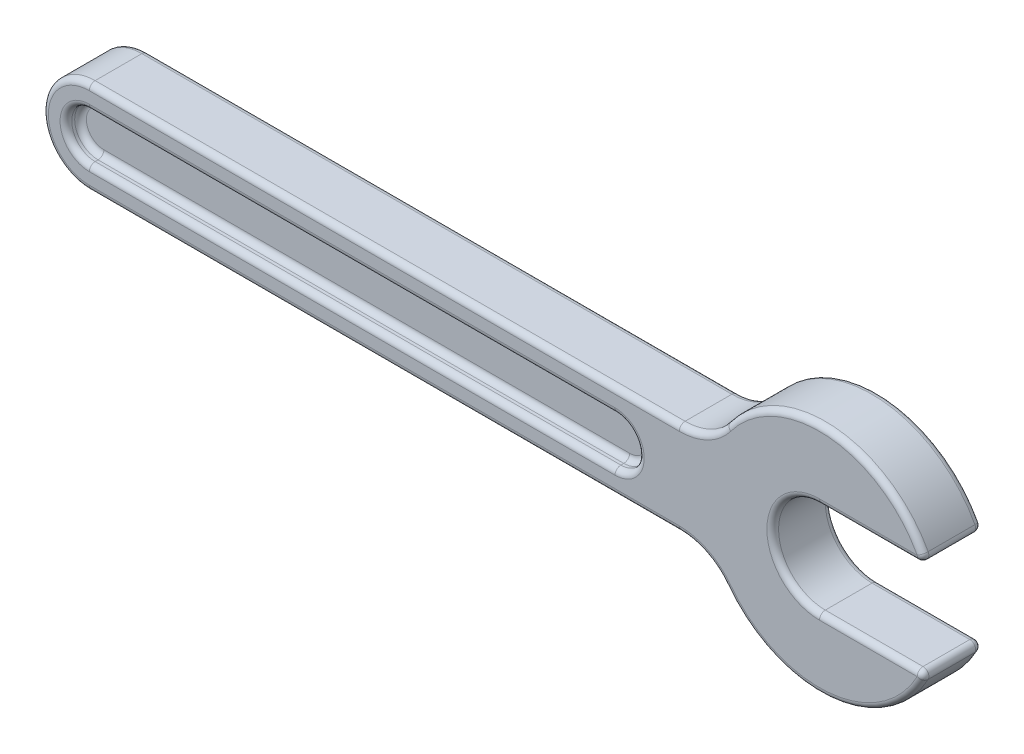
from build123d import *

# Parameters (mm, degrees)
BOSS_EXTRUDE5_DEPTH = 10
BOSS_EXTRUDE6_DEPTH = 5
FILLET1_R           = 2


with BuildPart() as part:
    # Sketch1 → Boss-Extrude5 (new, symmetric)
    with BuildSketch(Plane.XY):
        with BuildLine():
            Line((36.66060556, 16), (0, 16))
            ThreePointArc((0, 16), (-16, 0), (0, -16))
            Line((0, -16), (36.66060556, -16))
            ThreePointArc((36.66060556, -16), (4.629288395, -39.731218065), (-32, -24))
            ThreePointArc((-32, -24), (-39.05572809, -18.11145618), (-48, -16))
            Line((-48, -16), (-250, -16))
            ThreePointArc((-250, -16), (-266, 0), (-250, 16))
            Line((-250, 16), (-48, 16))
            ThreePointArc((-48, 16), (-39.05572809, 18.11145618), (-32, 24))
            ThreePointArc((-32, 24), (4.629288395, 39.731218065), (36.66060556, 16))
        make_face()
        with BuildLine():
            Line((-250, 8), (-70, 8))
            ThreePointArc((-70, 8), (-62, 0), (-70, -8))
            Line((-70, -8), (-250, -8))
            ThreePointArc((-250, -8), (-258, 0), (-250, 8))
        make_face(mode=Mode.SUBTRACT)
    extrude(amount=BOSS_EXTRUDE5_DEPTH, both=True)

    # Sketch1<8> → Boss-Extrude6 (add, symmetric)
    with BuildSketch(Plane.XY):
        with BuildLine():
            Line((-70, 8), (-250, 8))
            ThreePointArc((-250, 8), (-258, 0), (-250, -8))
            Line((-250, -8), (-70, -8))
            ThreePointArc((-70, -8), (-62, 0), (-70, 8))
        make_face()
    extrude(amount=BOSS_EXTRUDE6_DEPTH, both=True)

    # Fillet1
    fillet1_edges = [part.edges().sort_by_distance(p)[0] for p in [
        (36.66060556, 16, 0),
        (36.66060556, -16, 0),
        (18.33030278, 16, 10),
        (4.629288395, 39.731218065, 10),
        (-39.05572809, 18.11145618, 10),
        (-149, 16, 10),
        (-266, 0, 10),
        (-149, -16, 10),
        (-39.05572809, -18.11145618, 10),
        (4.629288395, -39.731218065, 10),
        (18.33030278, -16, 10),
        (-16, 0, 10),
        (18.33030278, 16, -10),
        (4.629288395, 39.731218065, -10),
        (-39.05572809, 18.11145618, -10),
        (-149, 16, -10),
        (-266, 0, -10),
        (-149, -16, -10),
        (-39.05572809, -18.11145618, -10),
        (4.629288395, -39.731218065, -10),
        (18.33030278, -16, -10),
        (-16, 0, -10),
        (-160, 8, 10),
        (-62, 0, 10),
        (-160, -8, 10),
        (-258, 0, 10),
        (-160, 8, -10),
        (-62, 0, -10),
        (-160, -8, -10),
        (-258, 0, -10),
        (-258, 0, 5),
        (-160, 8, 5),
        (-62, 0, 5),
        (-160, -8, 5),
        (-258, 0, -5),
        (-160, 8, -5),
        (-62, 0, -5),
        (-160, -8, -5),
    ]]
    fillet(fillet1_edges, radius=FILLET1_R)


solid = part.part
